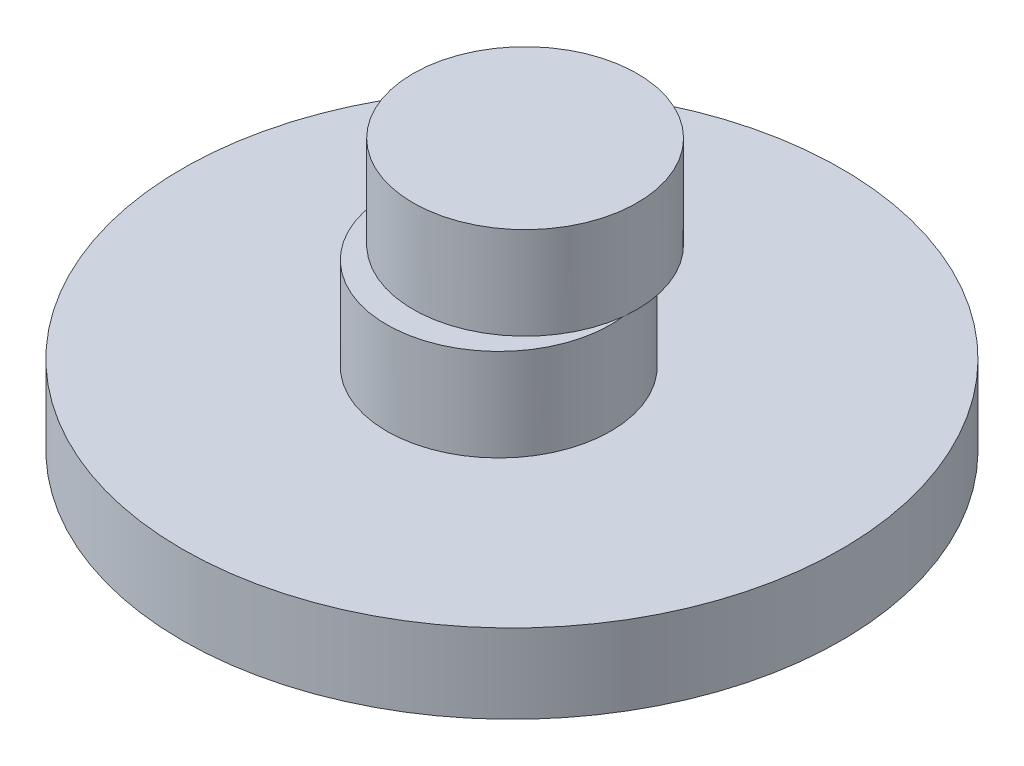
from build123d import *

# Parameters (mm, degrees)
SKETCH1_R           = 8.5
SKETCH1_R_2         = 4
BOSS_EXTRUDE1_DEPTH = 7
SKETCH3_R           = 25
SKETCH3_R_2         = 4
BOSS_EXTRUDE3_DEPTH = 6
SKETCH4_R           = 8.5
SKETCH4_R_2         = 4
BOSS_EXTRUDE4_DEPTH = 7
SKETCH5_R           = 8.5
SKETCH5_R_2         = 4
BOSS_EXTRUDE5_DEPTH = 7
BOSS_EXTRUDE6_START = -3
SKETCH6_R           = 8.5
BOSS_EXTRUDE6_DEPTH = 3


with BuildPart() as part:
    # Sketch1 → Boss-Extrude1 (new body)
    with BuildSketch(Plane(origin=(0, 0, 0), x_dir=(1, 0, 0), z_dir=(0, 1, 0))):
        with Locations(Location((0, 0, 0), (0, 0, 270))):
            Circle(SKETCH1_R)
        with Locations(Location((0, 0, 0), (0, 0, 270))):
            Circle(SKETCH1_R_2, mode=Mode.SUBTRACT)
    extrude(amount=BOSS_EXTRUDE1_DEPTH)

    # Sketch3 → Boss-Extrude3 (add)
    with BuildSketch(Plane(origin=(0, 7, 0), x_dir=(1, 0, 0), z_dir=(0, 1, 0))):
        with Locations(Location((0, 0, 0), (0, 0, 270))):
            Circle(SKETCH3_R)
        with Locations(Location((0, 0, 0), (0, 0, 270))):
            Circle(SKETCH3_R_2, mode=Mode.SUBTRACT)
    extrude(amount=BOSS_EXTRUDE3_DEPTH)

    # Sketch4 → Boss-Extrude4 (add)
    with BuildSketch(Plane(origin=(0, 13, 0), x_dir=(1, 0, 0), z_dir=(0, 1, 0))):
        with Locations(Location((0, -1, 0), (0, 0, 270))):
            Circle(SKETCH4_R)
        with Locations(Location((0, 0, 0), (0, 0, 270))):
            Circle(SKETCH4_R_2, mode=Mode.SUBTRACT)
    extrude(amount=BOSS_EXTRUDE4_DEPTH)

    # Sketch5 → Boss-Extrude5 (add)
    with BuildSketch(Plane(origin=(0, 20, 0), x_dir=(1, 0, 0), z_dir=(0, 1, 0))):
        with Locations(Location((0, 1, 0), (0, 0, 186.756327031))):
            Circle(SKETCH5_R)
        with Locations(Location((0, 0, 0), (0, 0, 270))):
            Circle(SKETCH5_R_2, mode=Mode.SUBTRACT)
    extrude(amount=BOSS_EXTRUDE5_DEPTH)

    # Sketch6 → Boss-Extrude6 (add)
    with BuildSketch(Plane(origin=(0, 27, 0), x_dir=(1, 0, 0), z_dir=(0, 1, 0)).offset(BOSS_EXTRUDE6_START)):
        with Locations(Location((0, 1, 0), (0, 0, 186.756327031))):
            Circle(SKETCH6_R)
    extrude(amount=BOSS_EXTRUDE6_DEPTH)


solid = part.part
